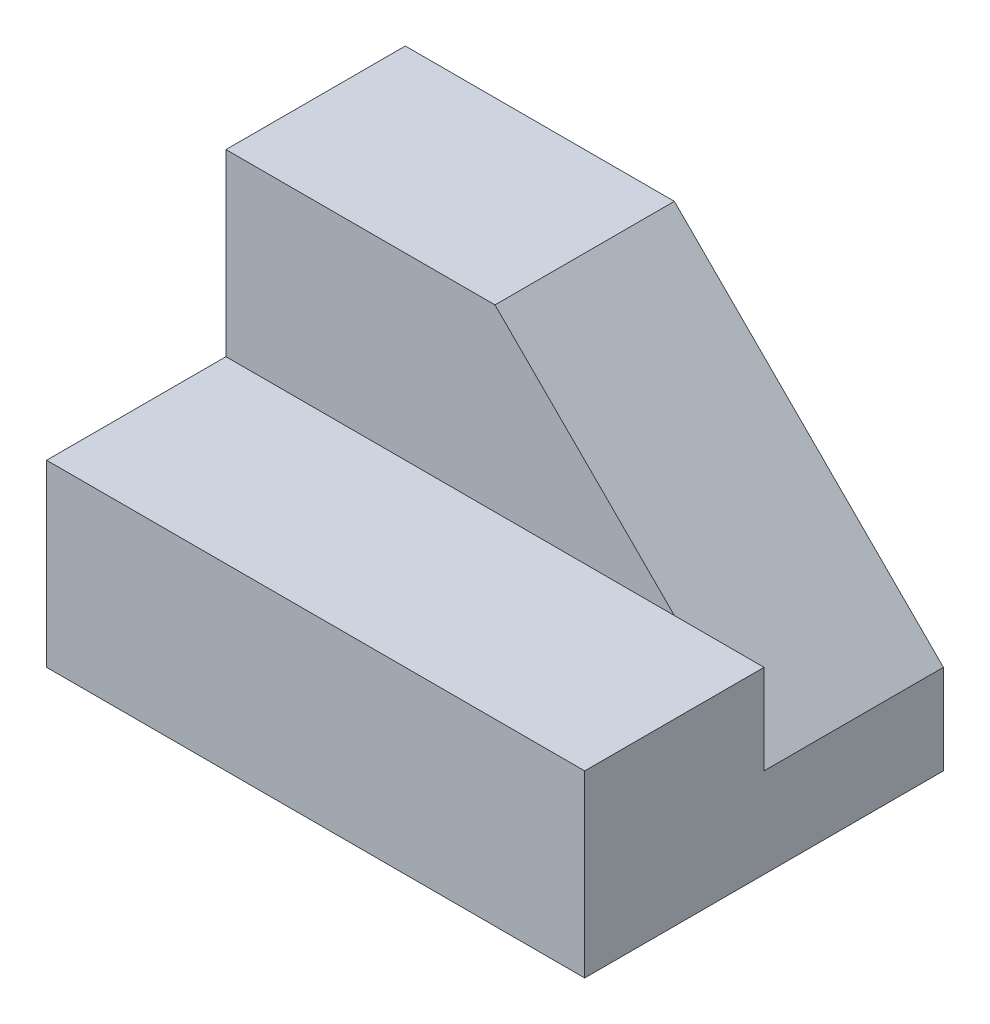
from build123d import *

# Parameters (mm, degrees)
SKETCH_1_W      = 30
SKETCH_1_H      = 10
EXTRUDE_1_DEPTH = 10
EXTRUDE_2_DEPTH = 10
SKETCH_3_W      = 30
SKETCH_3_H      = 5
EXTRUDE_3_DEPTH = 10


with BuildPart() as part:
    # 草圖1 → 填料-伸長1 (new body)
    with BuildSketch(Plane(origin=(0, 0, 0), x_dir=(1, 0, 0), z_dir=(0, 1, 0))):
        with Locations((15, 5)):
            Rectangle(SKETCH_1_W, SKETCH_1_H)
    extrude(amount=EXTRUDE_1_DEPTH)

    # 草圖2 → 填料-伸長2 (add)
    with BuildSketch(Plane(origin=(0, 0, -10), x_dir=(-1, 0, 0), z_dir=(0, 0, -1))):
        Polygon((0, 5), (0, 20), (-15, 20), (-30, 5), align=None)
    extrude(amount=EXTRUDE_2_DEPTH)

    # 草圖3 → 填料-伸長3 (add)
    with BuildSketch(Plane(origin=(0, 0, -10), x_dir=(-1, 0, 0), z_dir=(0, 0, -1))):
        with Locations((-15, 2.5)):
            Rectangle(SKETCH_3_W, SKETCH_3_H)
    extrude(amount=EXTRUDE_3_DEPTH)


solid = part.part
